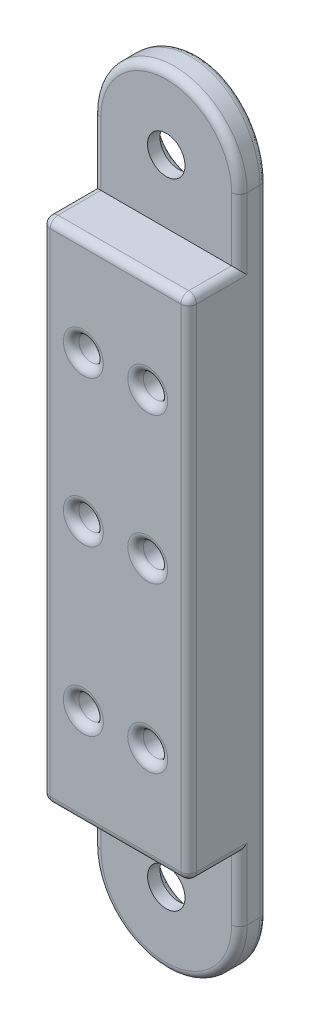
from build123d import *

# Parameters (mm, degrees)
MAIN_PROFILE_DEPTH                             = 50.8
END_ROUNDS_DEPTH                               = 25.4
SKETCH3_W                                      = 3.302
SKETCH3_H                                      = 4.7625
SKETCH3_H_2                                    = 4.1275
LOCATING_FLANGE_DEPTH                          = 53.111155755
BUTTON_POCKETS_DEPTH                           = 3.81
CBORE_FOR_2_SOCKET_HEAD_CAP_SCREW1_D           = 2.4384
CBORE_FOR_2_SOCKET_HEAD_CAP_SCREW1_CBORE_D     = 4.572
CBORE_FOR_2_SOCKET_HEAD_CAP_SCREW1_CBORE_DEPTH = 1.27
F_1_16_0_0625_DIAMETER_HOLE1_D                 = 1.5875
FILLET1_R                                      = 0.508


with BuildPart() as part:
    # Sketch1 → Main profile (new body)
    with BuildSketch(Plane(origin=(0, 0, 0), x_dir=(1, 0, 0), z_dir=(0, 1, 0))):
        with BuildLine():
            Line((-4.191328185, 1.27), (5.333671815, 1.27))
            Line((5.333671815, 1.27), (5.333671815, 6.35))
            ThreePointArc((5.333671815, 6.35), (0.571171815, 6.648828143), (-4.191328185, 6.35))
            Line((-4.191328185, 6.35), (-4.191328185, 1.27))
        make_face()
    extrude(amount=MAIN_PROFILE_DEPTH)

    # Sketch2 → End rounds (cut)
    with BuildSketch(Plane.XY.offset(-1.27)):
        with BuildLine():
            Line((-4.191328185, 50.8), (-4.191328185, 46.0375))
            ThreePointArc((-4.191328185, 46.0375), (-2.796424231, 49.405096045), (0.571171815, 50.8))
            Line((0.571171815, 50.8), (-4.191328185, 50.8))
        make_face()
        with BuildLine():
            Line((5.333671815, 50.8), (0.571171815, 50.8))
            ThreePointArc((0.571171815, 50.8), (3.93876786, 49.405096045), (5.333671815, 46.0375))
            Line((5.333671815, 46.0375), (5.333671815, 50.8))
        make_face()
        with BuildLine():
            ThreePointArc((5.333671815, 4.7625), (3.938767861, 1.394903955), (0.571171817, 0))
            Line((0.571171817, 0), (5.333671815, 0))
            Line((5.333671815, 0), (5.333671815, 4.7625))
        make_face()
        with BuildLine():
            ThreePointArc((0.571171817, 0), (-2.79642423, 1.394903954), (-4.191328185, 4.7625))
            Line((-4.191328185, 4.7625), (-4.191328185, 0))
            Line((-4.191328185, 0), (0.571171817, 0))
        make_face()
    extrude(amount=-END_ROUNDS_DEPTH, mode=Mode.SUBTRACT)

    # Sketch3 → Locating Flange (cut, through all)
    with BuildSketch(Plane.ZY.offset(4.191328185)):
        with Locations((-2.921, 2.38125)):
            Rectangle(SKETCH3_W, SKETCH3_H)
        with Locations((-2.921, 6.82625)):
            Rectangle(SKETCH3_W, SKETCH3_H_2)
        with Locations((-2.921, 43.97375)):
            Rectangle(SKETCH3_W, SKETCH3_H_2)
        with Locations((-2.921, 48.41875)):
            Rectangle(SKETCH3_W, SKETCH3_H)
    extrude(amount=-LOCATING_FLANGE_DEPTH, mode=Mode.SUBTRACT)

    # Sketch4 → Button Pockets (cut)
    with BuildSketch(Plane(origin=(0, 0, -6.648828143), x_dir=(-1, 0, 0), z_dir=(0, 0, -1))):
        with BuildLine():
            Line((-2.682671815, 38.735), (1.540328185, 38.735))
            ThreePointArc((1.540328185, 38.735), (2.337237528, 38.404909342), (2.667328185, 37.608))
            Line((2.667328185, 37.608), (2.667328185, 33.385))
            ThreePointArc((2.667328185, 33.385), (2.337237528, 32.588090658), (1.540328185, 32.258))
            Line((1.540328185, 32.258), (-2.682671815, 32.258))
            ThreePointArc((-2.682671815, 32.258), (-3.479581157, 32.588090658), (-3.809671815, 33.385))
            Line((-3.809671815, 33.385), (-3.809671815, 37.608))
            ThreePointArc((-3.809671815, 37.608), (-3.479581157, 38.404909342), (-2.682671815, 38.735))
        make_face()
        with BuildLine():
            Line((-2.682671815, 29.226), (1.540328185, 29.226))
            ThreePointArc((1.540328185, 29.226), (2.337237528, 28.895909342), (2.667328185, 28.099))
            Line((2.667328185, 28.099), (2.667328185, 23.876))
            ThreePointArc((2.667328185, 23.876), (2.337237528, 23.079090658), (1.540328185, 22.749))
            Line((1.540328185, 22.749), (-2.682671815, 22.749))
            ThreePointArc((-2.682671815, 22.749), (-3.479581157, 23.079090658), (-3.809671815, 23.876))
            Line((-3.809671815, 23.876), (-3.809671815, 28.099))
            ThreePointArc((-3.809671815, 28.099), (-3.479581157, 28.895909342), (-2.682671815, 29.226))
        make_face()
        with BuildLine():
            Line((-2.682671815, 18.542), (1.540328185, 18.542))
            ThreePointArc((1.540328185, 18.542), (2.337237528, 18.211909342), (2.667328185, 17.415))
            Line((2.667328185, 17.415), (2.667328185, 13.192))
            ThreePointArc((2.667328185, 13.192), (2.337237528, 12.395090658), (1.540328185, 12.065))
            Line((1.540328185, 12.065), (-2.682671815, 12.065))
            ThreePointArc((-2.682671815, 12.065), (-3.479581157, 12.395090658), (-3.809671815, 13.192))
            Line((-3.809671815, 13.192), (-3.809671815, 17.415))
            ThreePointArc((-3.809671815, 17.415), (-3.479581157, 18.211909342), (-2.682671815, 18.542))
        make_face()
    extrude(amount=-BUTTON_POCKETS_DEPTH, mode=Mode.SUBTRACT)

    # CBORE for #2 Socket Head Cap Screw1 (through all)
    with Locations(Plane(origin=(0, 0, -6.648828143), x_dir=(-1, 0, 0), z_dir=(0, 0, -1))):
        with Locations((-0.571171815, 46.0375), (-0.571171815, 4.7625)):
            CounterBoreHole(CBORE_FOR_2_SOCKET_HEAD_CAP_SCREW1_D / 2, CBORE_FOR_2_SOCKET_HEAD_CAP_SCREW1_CBORE_D / 2, CBORE_FOR_2_SOCKET_HEAD_CAP_SCREW1_CBORE_DEPTH)

    # 1/16 (0.0625) Diameter Hole1 (through all)
    with Locations(Plane.XY.offset(-1.27)):
        with Locations((-1.524328185, 35.4965), (2.666671815, 35.4965), (2.666671815, 25.9875), (-1.524328185, 25.9875), (-1.524328185, 15.3035), (2.666671815, 15.3035)):
            Hole(F_1_16_0_0625_DIAMETER_HOLE1_D / 2)

    # Fillet1
    fillet1_edges = [part.edges().sort_by_distance(p)[0] for p in [
        (5.333671815, 43.97375, -4.572),
        (5.333671815, 41.91, -2.921),
        (0.571171815, 41.91, -1.27),
        (-4.191328185, 43.97375, -4.572),
        (-4.191328185, 41.91, -2.921),
        (-4.191328185, 25.4, -6.35),
        (0.571171815, 50.8, -6.648828143),
        (2.857171814, 4.762500002, -6.58018631),
        (2.857171814, 46.037500002, -6.58018631),
        (3.460421815, 15.3035, -1.27),
        (-0.730578185, 15.3035, -1.27),
        (-0.730578185, 25.9875, -1.27),
        (3.460421815, 25.9875, -1.27),
        (3.460421815, 35.4965, -1.27),
        (0.571171817, 0, -6.648828143),
        (-0.730578185, 35.4965, -1.27),
        (5.333671815, 25.4, -6.35),
        (0.571171815, 50.8, -4.572),
        (0.571171815, 0, -4.572),
        (-4.191328185, 25.4, -1.27),
        (5.333671815, 25.4, -1.27),
        (0.571171815, 8.89, -1.27),
        (5.333671815, 6.82625, -4.572),
        (-4.191328185, 6.82625, -4.572),
        (-4.191328185, 8.89, -2.921),
        (5.333671815, 8.89, -2.921),
    ]]
    fillet(fillet1_edges, radius=FILLET1_R)


solid = part.part
